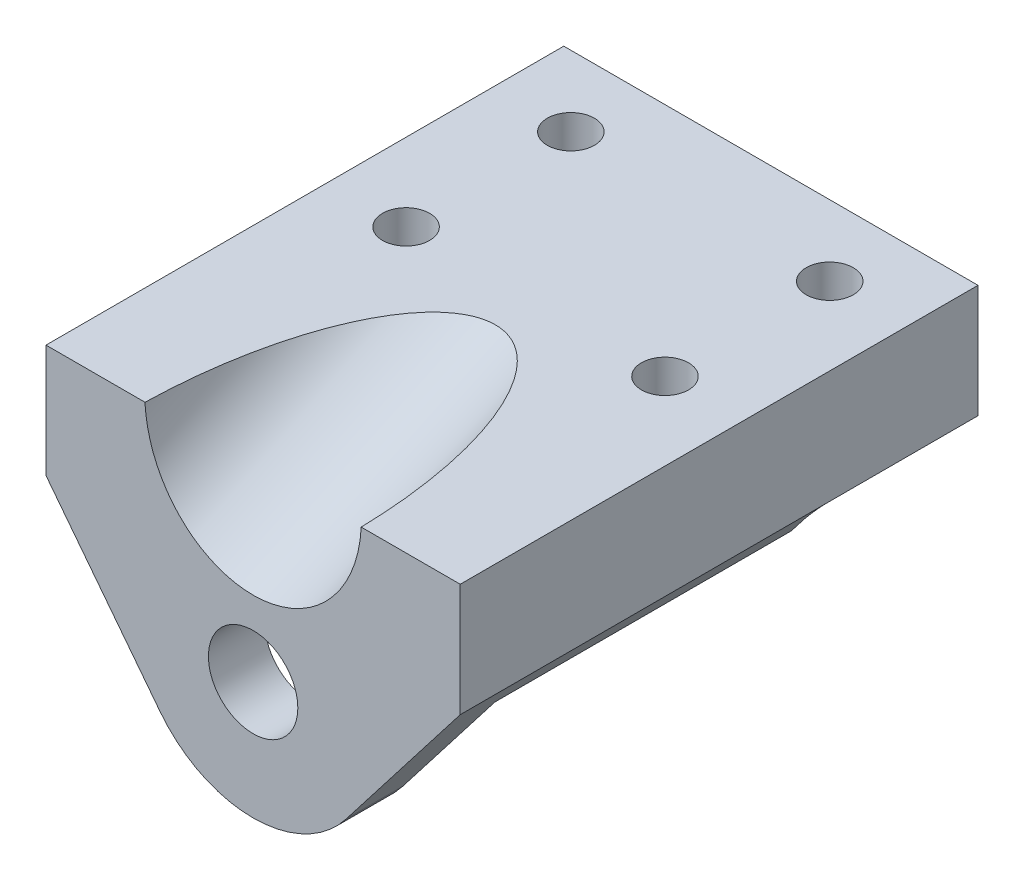
from build123d import *

# Parameters (mm, degrees)
BOSS_EXTRUDE1_DEPTH            = 44
CUT_EXTRUDE1_REACH             = 129.516
SKETCH5_R                      = 23
CUT_EXTRUDE1_DIRECTION_2_REACH = 129.516
CUT_EXTRUDE2_REACH             = 137.133
SKETCH6_R                      = 5
CUT_EXTRUDE3_REACH             = 137.133
SKETCH7_R                      = 9.5


with BuildPart() as part:
    # Sketch1 → Boss-Extrude1 (new, symmetric)
    with BuildSketch(Plane(origin=(0, 0, 0), x_dir=(0, 0, -1), z_dir=(1, 0, 0))):
        with BuildLine():
            Line((0, 0), (0, -65))
            Line((0, -65), (12, -65))
            Line((12, -65), (12, -30))
            Line((12, -30), (75, -30))
            Line((75, -30), (75, -27))
            ThreePointArc((75, -27), (75.878679656, -24.878679656), (78, -24))
            Line((78, -24), (110, -24))
            Line((110, -24), (110, 0))
            Line((110, 0), (0, 0))
        make_face()
    extrude(amount=BOSS_EXTRUDE1_DEPTH, both=True)

    # Sketch5 → Cut-Extrude1 (cut, up to next)
    with BuildSketch(Plane(origin=(0, 6.55814551, -14.063988431), x_dir=(1, 0, 0), z_dir=(0, -0.42261826174069383, 0.9063077870366527)), mode=Mode.PRIVATE) as cut_extrude1_sk1:
        with Locations((0, 1.248613111)):
            Circle(SKETCH5_R)
    cut_extrude1_tool1 = extrude(cut_extrude1_sk1.sketch, amount=-CUT_EXTRUDE1_REACH, mode=Mode.PRIVATE) & part.part
    add(cut_extrude1_tool1.solids().sort_by_distance((0, 7.689773, -13.536302))[0], mode=Mode.SUBTRACT)

    # Sketch5 → Cut-Extrude1 direction 2 (cut, up to next)
    with BuildSketch(Plane(origin=(0, 6.55814551, -14.063988431), x_dir=(1, 0, 0), z_dir=(0, -0.42261826174069383, 0.9063077870366527)), mode=Mode.PRIVATE) as cut_extrude1_direction_2_sk1:
        with Locations((0, 1.248613111)):
            Circle(SKETCH5_R)
    cut_extrude1_direction_2_tool1 = extrude(cut_extrude1_direction_2_sk1.sketch, amount=CUT_EXTRUDE1_DIRECTION_2_REACH, mode=Mode.PRIVATE) & part.part
    add(cut_extrude1_direction_2_tool1.solids().sort_by_distance((0, 7.689773, -13.536302))[0], mode=Mode.SUBTRACT)

    # Sketch6 → Cut-Extrude2 (cut, up to next)
    with BuildSketch(Plane(origin=(0, 0, 0), x_dir=(1, 0, 0), z_dir=(0, 1, 0)), mode=Mode.PRIVATE) as cut_extrude2_sk1:
        with Locations(Location((27.5, 95, 0), (0, 0, 270))):
            Circle(SKETCH6_R)
    cut_extrude2_tool1 = extrude(cut_extrude2_sk1.sketch, amount=-CUT_EXTRUDE2_REACH, mode=Mode.PRIVATE) & part.part
    # Sketch6 → Cut-Extrude2 (cut, up to next)
    with BuildSketch(Plane(origin=(0, 0, 0), x_dir=(1, 0, 0), z_dir=(0, 1, 0)), mode=Mode.PRIVATE) as cut_extrude2_sk2:
        with Locations(Location((-27.5, 95, 0), (0, 0, 270))):
            Circle(SKETCH6_R)
    cut_extrude2_tool2 = extrude(cut_extrude2_sk2.sketch, amount=-CUT_EXTRUDE2_REACH, mode=Mode.PRIVATE) & part.part
    # Sketch6 → Cut-Extrude2 (cut, up to next)
    with BuildSketch(Plane(origin=(0, 0, 0), x_dir=(1, 0, 0), z_dir=(0, 1, 0)), mode=Mode.PRIVATE) as cut_extrude2_sk3:
        with Locations(Location((-27.5, 60, 0), (0, 0, 270))):
            Circle(SKETCH6_R)
    cut_extrude2_tool3 = extrude(cut_extrude2_sk3.sketch, amount=-CUT_EXTRUDE2_REACH, mode=Mode.PRIVATE) & part.part
    # Sketch6 → Cut-Extrude2 (cut, up to next)
    with BuildSketch(Plane(origin=(0, 0, 0), x_dir=(1, 0, 0), z_dir=(0, 1, 0)), mode=Mode.PRIVATE) as cut_extrude2_sk4:
        with Locations(Location((27.5, 60, 0), (0, 0, 270))):
            Circle(SKETCH6_R)
    cut_extrude2_tool4 = extrude(cut_extrude2_sk4.sketch, amount=-CUT_EXTRUDE2_REACH, mode=Mode.PRIVATE) & part.part
    add(cut_extrude2_tool1.solids().sort_by_distance((27.5, 0, -95))[0], mode=Mode.SUBTRACT)
    add(cut_extrude2_tool2.solids().sort_by_distance((-27.5, 0, -95))[0], mode=Mode.SUBTRACT)
    add(cut_extrude2_tool3.solids().sort_by_distance((-27.5, 0, -60))[0], mode=Mode.SUBTRACT)
    add(cut_extrude2_tool4.solids().sort_by_distance((27.5, 0, -60))[0], mode=Mode.SUBTRACT)

    # Sketch7 → Cut-Extrude3 (cut, up to next)
    with BuildSketch(Plane.XY, mode=Mode.PRIVATE) as cut_extrude3_sk1:
        with BuildLine():
            Line((44, -65), (44, -24))
            Line((44, -24), (19.769224603, -55.302867659))
            ThreePointArc((19.769224603, -55.302867659), (11.009729981, -62.445174219), (0, -65))
            Line((0, -65), (44, -65))
        make_face()
    cut_extrude3_tool1 = extrude(cut_extrude3_sk1.sketch, amount=-CUT_EXTRUDE3_REACH, mode=Mode.PRIVATE) & part.part
    # Sketch7 → Cut-Extrude3 (cut, up to next)
    with BuildSketch(Plane.XY, mode=Mode.PRIVATE) as cut_extrude3_sk2:
        with Locations((0, -40)):
            Circle(SKETCH7_R)
    cut_extrude3_tool2 = extrude(cut_extrude3_sk2.sketch, amount=-CUT_EXTRUDE3_REACH, mode=Mode.PRIVATE) & part.part
    # Sketch7 → Cut-Extrude3 (cut, up to next)
    with BuildSketch(Plane.XY, mode=Mode.PRIVATE) as cut_extrude3_sk3:
        with BuildLine():
            Line((-44, -65), (0, -65))
            ThreePointArc((0, -65), (-11.009729981, -62.445174219), (-19.769224603, -55.302867659))
            Line((-19.769224603, -55.302867659), (-44, -24))
            Line((-44, -24), (-44, -65))
        make_face()
    cut_extrude3_tool3 = extrude(cut_extrude3_sk3.sketch, amount=-CUT_EXTRUDE3_REACH, mode=Mode.PRIVATE) & part.part
    add(cut_extrude3_tool1.solids().sort_by_distance((32.710915, -51.707074, 0))[0], mode=Mode.SUBTRACT)
    add(cut_extrude3_tool2.solids().sort_by_distance((0, -40, 0))[0], mode=Mode.SUBTRACT)
    add(cut_extrude3_tool3.solids().sort_by_distance((-32.710915, -51.707074, 0))[0], mode=Mode.SUBTRACT)


solid = part.part
